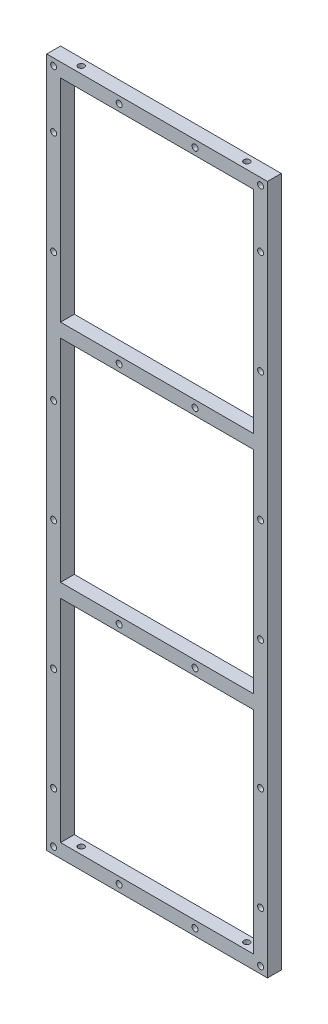
from build123d import *

# Parameters (mm, degrees)
SKETCH1_W           = 96
SKETCH1_H           = 300
SKETCH1_W_2         = 84
SKETCH1_H_2         = 92
BOSS_EXTRUDE1_DEPTH = 6
SKETCH2_R           = 1.3
CUT_EXTRUDE1_DEPTH  = 6
SKETCH4_R           = 1.3
CUT_EXTRUDE5_DEPTH  = 10
SKETCH3_R           = 1.3
CUT_EXTRUDE6_DEPTH  = 10


with BuildPart() as part:
    # Sketch1 → Boss-Extrude1 (new body)
    with BuildSketch(Plane.XY):
        Rectangle(SKETCH1_W, SKETCH1_H)
        with Locations((0, 98)):
            Rectangle(SKETCH1_W_2, SKETCH1_H_2, mode=Mode.SUBTRACT)
        with Locations((0, -98)):
            Rectangle(SKETCH1_W_2, SKETCH1_H_2, mode=Mode.SUBTRACT)
        Rectangle(SKETCH1_W_2, SKETCH1_H_2, mode=Mode.SUBTRACT)
    extrude(amount=BOSS_EXTRUDE1_DEPTH)

    # Sketch2 → Cut-Extrude1 (cut)
    with BuildSketch(Plane.XY.offset(6)):
        with Locations((-45, 147)):
            Circle(SKETCH2_R)
        with Locations((45, 147)):
            Circle(SKETCH2_R)
        with Locations((-45, -147)):
            Circle(SKETCH2_R)
        with Locations((45, -147)):
            Circle(SKETCH2_R)
    extrude(amount=-CUT_EXTRUDE1_DEPTH, mode=Mode.SUBTRACT)

    # Sketch4 → Cut-Extrude5 (cut)
    with BuildSketch(Plane(origin=(0, 150, 0), x_dir=(1, 0, 0), z_dir=(0, 1, 0))):
        with Locations(Location((-36, -3, 0), (0, 0, 270))):
            Circle(SKETCH4_R)
        with Locations(Location((36, -3, 0), (0, 0, 90))):
            Circle(SKETCH4_R)
    cut_extrude5 = extrude(amount=-CUT_EXTRUDE5_DEPTH, mode=Mode.SUBTRACT)

    # Mirror1: Cut-Extrude5 across plane
    add(cut_extrude5.mirror(Plane.ZX), mode=Mode.SUBTRACT)

    # Sketch3 → Cut-Extrude6 (cut)
    with BuildSketch(Plane.XY.offset(6)):
        with Locations((-45.000000047, 122)):
            Circle(SKETCH3_R)
        with Locations((-16.5, 147)):
            Circle(SKETCH3_R)
        with Locations(Location((16.5, 147, 0), (0, 0, 180))):
            Circle(SKETCH3_R)
        with Locations((-16.5, 49)):
            Circle(SKETCH3_R)
        with Locations(Location((16.5, 49, 0), (0, 0, 180))):
            Circle(SKETCH3_R)
        with Locations((-16.5, -49)):
            Circle(SKETCH3_R)
        with Locations(Location((16.5, -49, 0), (0, 0, 180))):
            Circle(SKETCH3_R)
        with Locations((-16.5, -147)):
            Circle(SKETCH3_R)
        with Locations(Location((16.5, -147, 0), (0, 0, 180))):
            Circle(SKETCH3_R)
        with Locations((-45.000000047, 21)):
            Circle(SKETCH3_R)
        with Locations((44.999999953, 122)):
            Circle(SKETCH3_R)
        with Locations((44.999999953, 77)):
            Circle(SKETCH3_R)
        with Locations((-45.000000047, 77)):
            Circle(SKETCH3_R)
        with Locations((44.999999953, 21)):
            Circle(SKETCH3_R)
        with Locations((44.999999953, -24)):
            Circle(SKETCH3_R)
        with Locations((-45.000000047, -24)):
            Circle(SKETCH3_R)
        with Locations((-45.000000047, -80)):
            Circle(SKETCH3_R)
        with Locations((44.999999953, -80)):
            Circle(SKETCH3_R)
        with Locations((44.999999953, -125)):
            Circle(SKETCH3_R)
        with Locations((-45.000000047, -125)):
            Circle(SKETCH3_R)
    extrude(amount=-CUT_EXTRUDE6_DEPTH, mode=Mode.SUBTRACT)


solid = part.part
